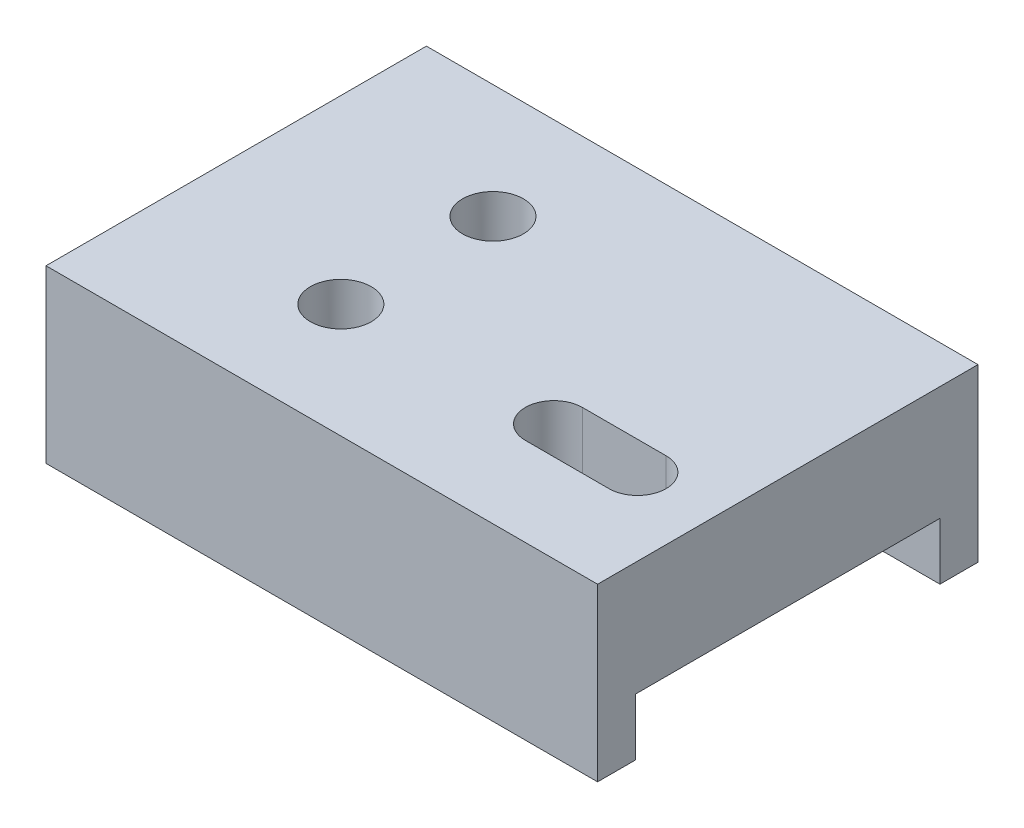
from build123d import *

# Parameters (mm, degrees)
EXTRU_MINCE1_DEPTH      = 9.5
ESQUISSE2_R             = 1.6
ENL_V_MAT_EXTRU_1_DEPTH = 27.196373795
ENL_V_START             = -2.5
ESQUISSE4_R             = 3
ENL_V_MAT_EXTRU_3_DEPTH = 24.696373795
SKETCH2_W               = 19
SKETCH2_H               = 8
CUT_EXTRUDE2_DEPTH      = 22.960191256
SKETCH4_W               = 19
SKETCH4_H               = 2
BOSS_EXTRUDE2_DEPTH     = 3
BOSS_EXTRUDE3_DEPTH     = 10
SKETCH6_R               = 1.5
CUT_EXTRUDE3_DEPTH      = 29.570089254
CUT_EXTRUDE6_DEPTH      = 29.570089254
LPATTERN1_COUNT         = 2
LPATTERN1_PITCH         = 8


with BuildPart() as part:
    # Esquisse1 → Extru.-Mince1 (new, symmetric)
    with BuildSketch(Plane(origin=(0, 0, 0), x_dir=(0, 0, -1), z_dir=(1, 0, 0))):
        Polygon((20, 0), (0, 0), (0, -14), (6, -14), (6, -6), (20, -6), align=None)
    extrude(amount=EXTRU_MINCE1_DEPTH, both=True)

    # Esquisse2 → Enlèv. mat.-Extru.1 (cut, through all)
    with BuildSketch(Plane(origin=(0, 0, 0), x_dir=(1, 0, 0), z_dir=(0, 1, 0))):
        with Locations((0, 14)):
            Circle(ESQUISSE2_R)
    enl_v_mat_extru_1 = extrude(amount=-ENL_V_MAT_EXTRU_1_DEPTH, mode=Mode.SUBTRACT)

    # Esquisse4 → Enlèv. mat.-Extru.3 (cut, through all)
    with BuildSketch(Plane(origin=(0, 0, 0), x_dir=(1, 0, 0), z_dir=(0, 1, 0)).offset(ENL_V_START)):
        with Locations((0, 14)):
            Circle(ESQUISSE4_R)
    enl_v_mat_extru_3 = extrude(amount=-ENL_V_MAT_EXTRU_3_DEPTH, mode=Mode.SUBTRACT)

    # Sketch2 → Cut-Extrude2 (cut, through all)
    with BuildSketch(Plane(origin=(0, 0, -6), x_dir=(-1, 0, 0), z_dir=(0, 0, -1))):
        with Locations((0, -10)):
            Rectangle(SKETCH2_W, SKETCH2_H)
    extrude(amount=-CUT_EXTRUDE2_DEPTH, mode=Mode.SUBTRACT)

    # Sketch4 → Boss-Extrude2 (add)
    with BuildSketch(Plane.XZ.offset(6)):
        with Locations((0, -1)):
            Rectangle(SKETCH4_W, SKETCH4_H)
        with Locations((0, -19)):
            Rectangle(SKETCH4_W, SKETCH4_H)
    extrude(amount=BOSS_EXTRUDE2_DEPTH)

    # Sketch5 → Boss-Extrude3 (add)
    with BuildSketch(Plane(origin=(9.5, 0, 0), x_dir=(0, 0, -1), z_dir=(1, 0, 0))):
        Polygon((0, 0), (0, -9), (2, -9), (2, -6), (18, -6), (18, -9), (20, -9), (20, 0), align=None)
    extrude(amount=BOSS_EXTRUDE3_DEPTH)

    # Sketch6 → Cut-Extrude3 (cut, through all)
    with BuildSketch(Plane.XZ.offset(6)):
        with Locations((11.05, -6.15)):
            Circle(SKETCH6_R)
    extrude(amount=-CUT_EXTRUDE3_DEPTH, mode=Mode.SUBTRACT)

    # Sketch7 → Cut-Extrude6 (cut, through all)
    with BuildSketch(Plane.XZ.offset(6)):
        with BuildLine():
            Line((11.05, -4.65), (15.450055752, -4.65))
            ThreePointArc((15.450055752, -4.65), (16.950055752, -6.15), (15.450055752, -7.65))
            Line((15.450055752, -7.65), (11.05, -7.65))
            ThreePointArc((11.05, -7.65), (12.55, -6.15), (11.05, -4.65))
        make_face()
    extrude(amount=-CUT_EXTRUDE6_DEPTH, mode=Mode.SUBTRACT)

    # LPattern1: Enlèv. mat.-Extru.1, Enlèv. mat.-Extru.3 ×2
    with Locations(*[(0, 0, i * LPATTERN1_PITCH) for i in range(1, LPATTERN1_COUNT)]):
        add(enl_v_mat_extru_1, mode=Mode.SUBTRACT)
        add(enl_v_mat_extru_3, mode=Mode.SUBTRACT)


solid = part.part
